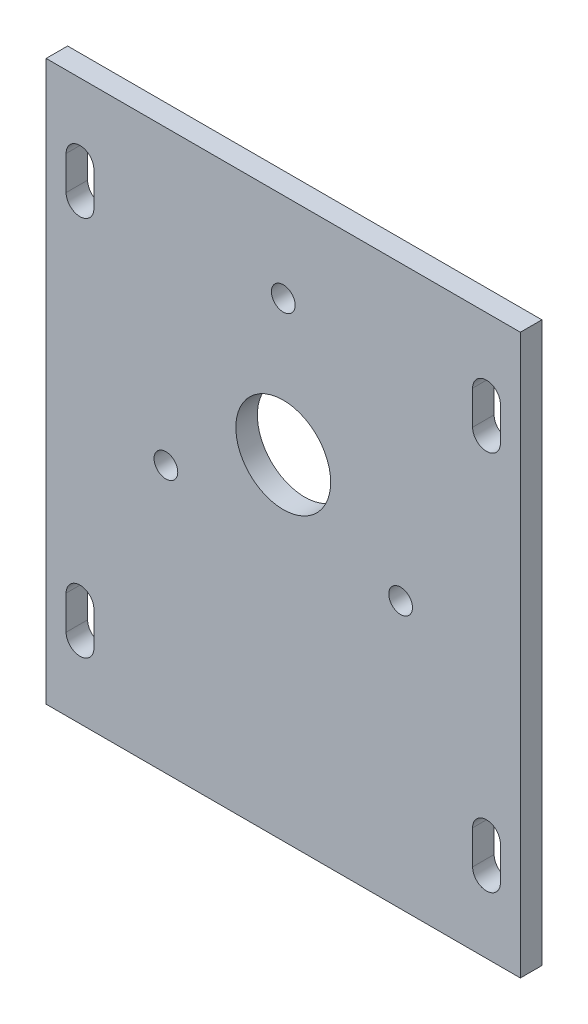
from build123d import *

# Parameters (mm, degrees)
SKETCH1_W           = 70
SKETCH1_H           = 76.2
SKETCH1_R           = 1.75
SKETCH1_R_2         = 7
BOSS_EXTRUDE1_DEPTH = 3.175
SKETCH3_W           = 70
SKETCH3_H           = 3.175
BOSS_EXTRUDE2_DEPTH = 3.175


with BuildPart() as part:
    # Sketch1 → Boss-Extrude1 (new body)
    with BuildSketch(Plane.XY):
        Rectangle(SKETCH1_W, SKETCH1_H)
        with Locations((0, 28.1)):
            Circle(SKETCH1_R, mode=Mode.SUBTRACT)
        with Locations((17.320508076, -1.9)):
            Circle(SKETCH1_R, mode=Mode.SUBTRACT)
        with Locations((-17.320508076, -1.9)):
            Circle(SKETCH1_R, mode=Mode.SUBTRACT)
        with Locations((0, 8.1)):
            Circle(SKETCH1_R_2, mode=Mode.SUBTRACT)
        with BuildLine():
            Line((-32.05, 25.6), (-32.05, 30.6))
            ThreePointArc((-32.05, 30.6), (-30, 32.65), (-27.95, 30.6))
            Line((-27.95, 30.6), (-27.95, 25.6))
            ThreePointArc((-27.95, 25.6), (-30, 23.55), (-32.05, 25.6))
        make_face(mode=Mode.SUBTRACT)
        with BuildLine():
            Line((32.05, 25.6), (32.05, 30.6))
            ThreePointArc((32.05, 30.6), (30, 32.65), (27.95, 30.6))
            Line((27.95, 30.6), (27.95, 25.6))
            ThreePointArc((27.95, 25.6), (30, 23.55), (32.05, 25.6))
        make_face(mode=Mode.SUBTRACT)
        with BuildLine():
            Line((-32.05, -25.6), (-32.05, -30.6))
            ThreePointArc((-32.05, -30.6), (-30, -32.65), (-27.95, -30.6))
            Line((-27.95, -30.6), (-27.95, -25.6))
            ThreePointArc((-27.95, -25.6), (-30, -23.55), (-32.05, -25.6))
        make_face(mode=Mode.SUBTRACT)
        with BuildLine():
            Line((32.05, -25.6), (32.05, -30.6))
            ThreePointArc((32.05, -30.6), (30, -32.65), (27.95, -30.6))
            Line((27.95, -30.6), (27.95, -25.6))
            ThreePointArc((27.95, -25.6), (30, -23.55), (32.05, -25.6))
        make_face(mode=Mode.SUBTRACT)
    extrude(amount=BOSS_EXTRUDE1_DEPTH)

    # Sketch3 → Boss-Extrude2 (add)
    with BuildSketch(Plane.XY.offset(3.175)):
        with Locations((0, 39.6875)):
            Rectangle(SKETCH3_W, SKETCH3_H)
        with Locations((0, -39.6875)):
            Rectangle(SKETCH3_W, SKETCH3_H)
    extrude(amount=-BOSS_EXTRUDE2_DEPTH)


solid = part.part
